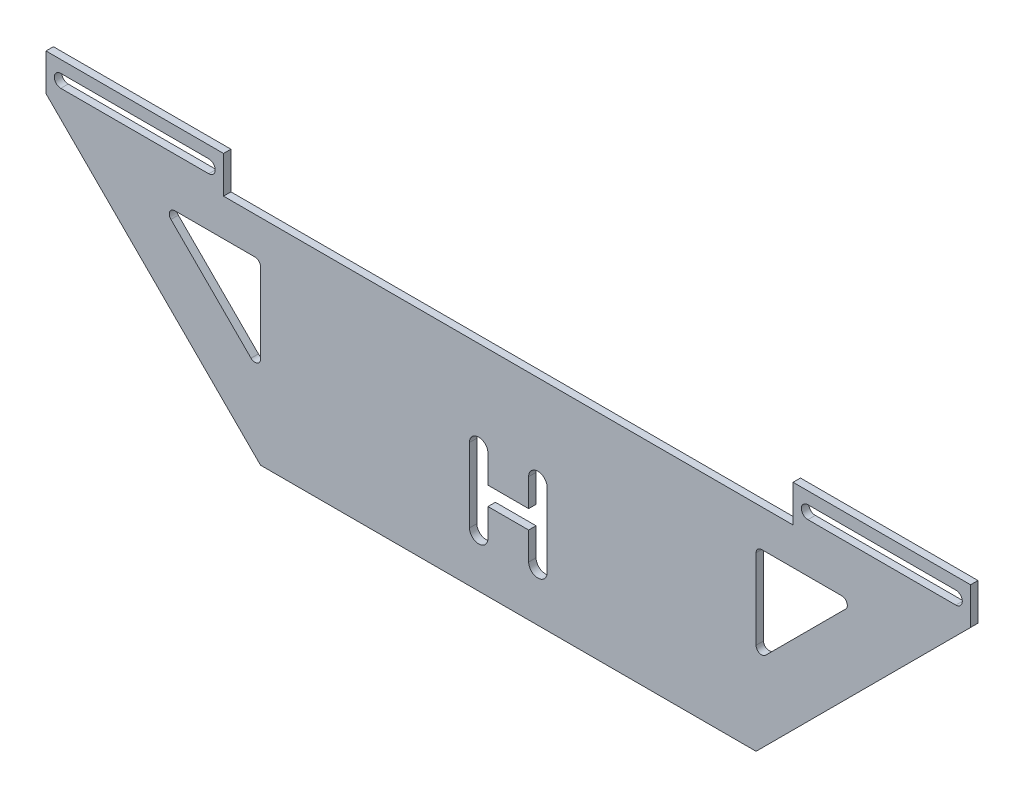
from build123d import *

# Parameters (mm, degrees)
SKETCH_1_R               = 1.5
EXTRUDE_1_DEPTH          = 2
SKETCH_3_W               = 250
SKETCH_3_H               = 20
CUT_EXTRUDE_2_DEPTH      = 138.815093513
CUT_EXTRUDE_3_DEPTH      = 138.815093513
CUT_EXTRUDE_3_DEPTH_BACK = 138.815093513
CUT_EXTRUDE_4_DEPTH      = 138.815093513


with BuildPart() as part:
    # 草图1 → 凸台-拉伸1 (new body)
    with BuildSketch(Plane.XY):
        Polygon((-77, 30), (-77, 0), (77, 0), (77, 30), (125, 30), (125, 0), (67, -58), (-67, -58), (-125, 0), (-125, 30), align=None)
        with Locations((-121, 25)):
            Circle(SKETCH_1_R, mode=Mode.SUBTRACT)
        with Locations((-81, 25)):
            Circle(SKETCH_1_R, mode=Mode.SUBTRACT)
        with Locations((-81, 5)):
            Circle(SKETCH_1_R, mode=Mode.SUBTRACT)
        with Locations((-121, 5)):
            Circle(SKETCH_1_R, mode=Mode.SUBTRACT)
        with Locations(Location((121, 5, 0), (0, 0, 180))):
            Circle(SKETCH_1_R, mode=Mode.SUBTRACT)
        with Locations(Location((81, 5, 0), (0, 0, 180))):
            Circle(SKETCH_1_R, mode=Mode.SUBTRACT)
        with Locations(Location((81, 25, 0), (0, 0, 180))):
            Circle(SKETCH_1_R, mode=Mode.SUBTRACT)
        with Locations(Location((121, 25, 0), (0, 0, 180))):
            Circle(SKETCH_1_R, mode=Mode.SUBTRACT)
    extrude(amount=EXTRUDE_1_DEPTH)

    # 草图3 → 切除-拉伸2 (cut, through all)
    with BuildSketch(Plane.XY.offset(2)):
        with Locations((0, 20)):
            Rectangle(SKETCH_3_W, SKETCH_3_H)
    extrude(amount=-CUT_EXTRUDE_2_DEPTH, mode=Mode.SUBTRACT)

    # 草图4 → 切除-拉伸3 (cut, two sides: drawn at the far end of the back side and taken through both)
    with BuildSketch(Plane.XY.offset(2).offset(-CUT_EXTRUDE_3_DEPTH_BACK)):
        with BuildLine():
            Line((-91.226136393, -12.560660172), (-69.560660172, -34.226136393))
            ThreePointArc((-69.560660172, -34.226136393), (-67.925974851, -34.55129552), (-67, -33.165476221))
            Line((-67, -33.165476221), (-67, -11.5))
            ThreePointArc((-67, -11.5), (-67.439339828, -10.439339828), (-68.5, -10))
            Line((-68.5, -10), (-90.165476221, -10))
            ThreePointArc((-90.165476221, -10), (-91.55129552, -10.925974851), (-91.226136393, -12.560660172))
        make_face()
        with BuildLine():
            Line((68.5, -10), (90.165476221, -10))
            ThreePointArc((90.165476221, -10), (91.55129552, -10.925974851), (91.226136393, -12.560660172))
            Line((91.226136393, -12.560660172), (69.560660172, -34.226136393))
            ThreePointArc((69.560660172, -34.226136393), (67.925974851, -34.55129552), (67, -33.165476221))
            Line((67, -33.165476221), (67, -11.5))
            ThreePointArc((67, -11.5), (67.439339828, -10.439339828), (68.5, -10))
        make_face()
        with BuildLine():
            Line((-5.5, -36.928047473), (-5.5, -44.428047473))
            ThreePointArc((-5.5, -44.428047473), (-8, -46.928047473), (-10.5, -44.428047473))
            Line((-10.5, -44.428047473), (-10.5, -24.428047473))
            ThreePointArc((-10.5, -24.428047473), (-8, -21.928047473), (-5.5, -24.428047473))
            Line((-5.5, -24.428047473), (-5.5, -31.928047473))
            Line((-5.5, -31.928047473), (5.5, -31.928047473))
            Line((5.5, -31.928047473), (5.5, -24.428047473))
            ThreePointArc((5.5, -24.428047473), (8, -21.928047473), (10.5, -24.428047473))
            Line((10.5, -24.428047473), (10.5, -44.428047473))
            ThreePointArc((10.5, -44.428047473), (8, -46.928047473), (5.5, -44.428047473))
            Line((5.5, -44.428047473), (5.5, -36.928047473))
            Line((5.5, -36.928047473), (-5.5, -36.928047473))
        make_face()
    extrude(amount=CUT_EXTRUDE_3_DEPTH + CUT_EXTRUDE_3_DEPTH_BACK, mode=Mode.SUBTRACT)

    # 草图5 → 切除-拉伸4 (cut, through all)
    with BuildSketch(Plane.XY.offset(2)):
        with BuildLine():
            Line((-121, 6.75), (-81, 6.75))
            ThreePointArc((-81, 6.75), (-79.25, 5), (-81, 3.25))
            Line((-81, 3.25), (-121, 3.25))
            ThreePointArc((-121, 3.25), (-122.75, 5), (-121, 6.75))
        make_face()
        with BuildLine():
            Line((81, 6.75), (121, 6.75))
            ThreePointArc((121, 6.75), (122.75, 5), (121, 3.25))
            Line((121, 3.25), (81, 3.25))
            ThreePointArc((81, 3.25), (79.25, 5), (81, 6.75))
        make_face()
    extrude(amount=-CUT_EXTRUDE_4_DEPTH, mode=Mode.SUBTRACT)


solid = part.part
